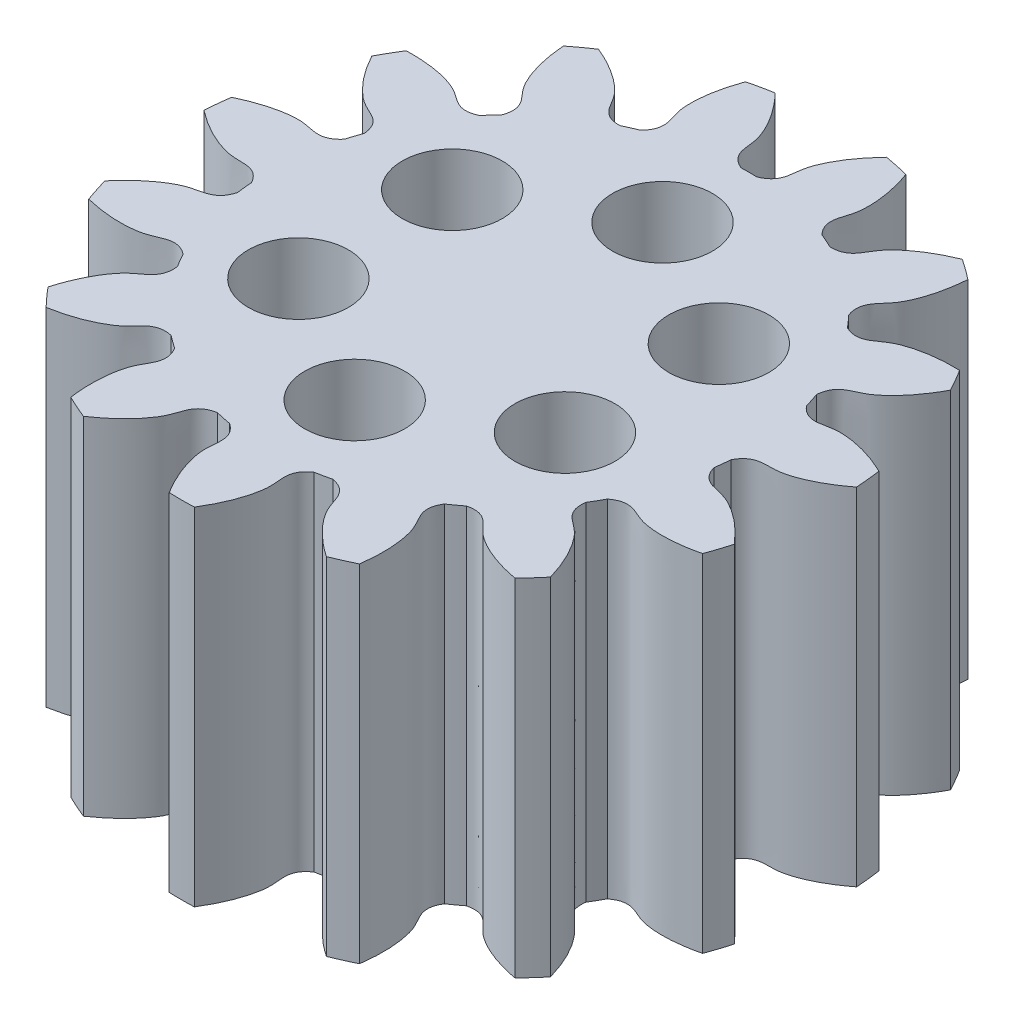
from build123d import *

# Parameters (mm, degrees)
EXTRUDE_1_DEPTH     = 18
SKETCH_2_R          = 2.6
CUT_EXTRUDE_1_DEPTH = 18


with BuildPart() as part:
    # 草图1 → 凸台-拉伸1 (new body)
    with BuildSketch(Plane(origin=(0, 0, 0), x_dir=(1, 0, 0), z_dir=(0, 1, 0))):
        with BuildLine():
            ThreePointArc((-4.070261012, 11.278074926), (-4.446224934, 11.11799604), (-4.816755697, 10.945714078))
            add(Edge.make_bspline(
                [(-4.816755697, 10.945714078), (-5.797025738, 10.920305027), (-5.927817302, 11.632519905), (-6.345451197, 12.170885551), (-6.388578566, 12.22303297), (-6.438114064, 12.279584992), (-6.498899692, 12.346247241), (-6.587266197, 12.437301497), (-6.709824462, 12.553923761), (-6.853878886, 12.680457628), (-7.02039085, 12.81534681), (-7.210231071, 12.956974861), (-7.424175956, 13.103670237), (-7.662904732, 13.253711239), (-7.926996695, 13.405331149), (-8.216928748, 13.556723506), (-8.516501887, 13.698220395), (-8.720849013, 13.785665189), (-8.81872037, 13.825629345)],
                knots=[0.470856003, 0.470856003, 0.470856003, 0.470856003, 0.673329104, 0.677834905, 0.68864883, 0.694956952, 0.701865848, 0.717485961, 0.735509167, 0.755935469, 0.778764864, 0.803997353, 0.831632937, 0.861671615, 0.894113387, 0.928958254, 0.966206214, 1, 1, 1, 1], degree=3))
            ThreePointArc((-8.81872037, 13.825629345), (-9.354366185, 13.451966724), (-9.875264115, 13.058005381))
            add(Edge.make_bspline(
                [(-9.875264115, 13.058005381), (-9.863151908, 12.893533817), (-9.835561849, 12.617123152), (-9.779430885, 12.238256379), (-9.720708052, 11.927964394), (-9.654716934, 11.642243515), (-9.58332055, 11.381143542), (-9.508372922, 11.144604888), (-9.431713259, 10.932459494), (-9.366147044, 10.771417396), (-9.30328234, 10.629675696), (-9.254588243, 10.527943239), (-9.206230218, 10.434459348), (-9.172603952, 10.37251769), (-9.140536365, 10.316160262), (-9.102059506, 10.251573668), (-9.065791453, 10.194442664), (-8.682831268, 9.630885093), (-8.045891484, 9.286408423), (-8.372977029, 8.361968042)],
                knots=[0, 0, 0, 0, 0.052718153, 0.088764566, 0.122407886, 0.153648111, 0.182485242, 0.208919278, 0.232950221, 0.254578069, 0.264490833, 0.282514039, 0.290624482, 0.298134152, 0.305043048, 0.31135117, 0.322165095, 0.326670896, 0.529143997, 0.529143997, 0.529143997, 0.529143997], degree=3))
            ThreePointArc((-8.372977029, 8.361968042), (-8.651327214, 8.062810399), (-8.919750523, 7.754714557))
            add(Edge.make_bspline(
                [(-8.919750523, 7.754714557), (-9.804936973, 7.332790488), (-10.214104901, 7.930233433), (-10.814605485, 8.252187915), (-10.875214563, 8.282285471), (-10.943469272, 8.313800412), (-11.026113685, 8.349975665), (-11.143875608, 8.39721597), (-11.303272702, 8.453906773), (-11.486338927, 8.510909), (-11.693319549, 8.566409882), (-11.924352537, 8.61857857), (-12.179467301, 8.665572241), (-12.458584063, 8.705541775), (-12.761513449, 8.736637577), (-13.087956379, 8.757015387), (-13.419182028, 8.764431854), (-13.641429419, 8.761201185), (-13.747094239, 8.75790239)],
                knots=[0.470856003, 0.470856003, 0.470856003, 0.470856003, 0.673329104, 0.677834905, 0.68864883, 0.694956952, 0.701865848, 0.717485961, 0.735509167, 0.755935469, 0.778764864, 0.803997353, 0.831632937, 0.861671615, 0.894113387, 0.928958254, 0.966206214, 1, 1, 1, 1], degree=3))
            ThreePointArc((-13.747094239, 8.75790239), (-14.08444876, 8.19867782), (-14.400074185, 7.626907949))
            add(Edge.make_bspline(
                [(-14.400074185, 7.626907949), (-14.32211252, 7.481582177), (-14.184481401, 7.240290357), (-13.979104214, 6.917008858), (-13.799251117, 6.657427752), (-13.622752079, 6.423249747), (-13.451329311, 6.213762578), (-13.286652308, 6.028157712), (-13.130332915, 5.865533545), (-13.004933475, 5.74508245), (-12.889852167, 5.641164343), (-12.803989578, 5.568032792), (-12.721789, 5.502299989), (-12.665875936, 5.459390503), (-12.613658106, 5.420948493), (-12.552238012, 5.377595652), (-12.495868224, 5.340155429), (-11.916797172, 4.98108391), (-11.194812441, 4.925455562), (-11.117616178, 3.947899575)],
                knots=[0, 0, 0, 0, 0.052718153, 0.088764566, 0.122407886, 0.153648111, 0.182485242, 0.208919278, 0.232950221, 0.254578069, 0.264490833, 0.282514039, 0.290624482, 0.298134152, 0.305043048, 0.31135117, 0.322165095, 0.326670896, 0.529143997, 0.529143997, 0.529143997, 0.529143997], degree=3))
            ThreePointArc((-11.117616178, 3.947899575), (-11.25022335, 3.561390249), (-11.370126375, 3.170753097))
            add(Edge.make_bspline(
                [(-11.370126375, 3.170753097), (-12.007172457, 2.425268515), (-12.623967896, 2.804636213), (-13.303503162, 2.854510677), (-13.371114089, 2.85735423), (-13.44628615, 2.85838287), (-13.536499379, 2.857816096), (-13.663294612, 2.853074174), (-13.83196933, 2.84003116), (-14.022393542, 2.817645544), (-14.234053992, 2.784161519), (-14.466332046, 2.737850405), (-14.718505027, 2.677016737), (-14.989747952, 2.600003708), (-15.279135518, 2.505198655), (-15.585644376, 2.39103841), (-15.891250613, 2.26309208), (-16.092969675, 2.16974456), (-16.188157552, 2.123753207)],
                knots=[0.470856003, 0.470856003, 0.470856003, 0.470856003, 0.673329104, 0.677834905, 0.68864883, 0.694956952, 0.701865848, 0.717485961, 0.735509167, 0.755935469, 0.778764864, 0.803997353, 0.831632937, 0.861671615, 0.894113387, 0.928958254, 0.966206214, 1, 1, 1, 1], degree=3))
            ThreePointArc((-16.188157552, 2.123753207), (-16.268889117, 1.475661695), (-16.324667532, 0.824947501))
            add(Edge.make_bspline(
                [(-16.324667532, 0.824947501), (-16.194336691, 0.723895669), (-15.970462183, 0.559444242), (-15.651350355, 0.347646324), (-15.381465227, 0.183660029), (-15.124976557, 0.041516402), (-14.883167958, -0.080135728), (-14.65723573, -0.182714039), (-14.44828565, -0.267697783), (-14.284735688, -0.326730787), (-14.13733638, -0.374856916), (-14.02915172, -0.406742451), (-13.927321815, -0.433358368), (-13.85878983, -0.449816241), (-13.795450694, -0.46369586), (-13.721707457, -0.478318848), (-13.654982783, -0.489594536), (-12.979927509, -0.582093275), (-12.29773555, -0.339254654), (-11.829605414, -1.200897937)],
                knots=[0, 0, 0, 0, 0.052718153, 0.088764566, 0.122407886, 0.153648111, 0.182485242, 0.208919278, 0.232950221, 0.254578069, 0.264490833, 0.282514039, 0.290624482, 0.298134152, 0.305043048, 0.31135117, 0.322165095, 0.326670896, 0.529143997, 0.529143997, 0.529143997, 0.529143997], degree=3))
            ThreePointArc((-11.829605414, -1.200897937), (-11.793540588, -1.607927971), (-11.744191008, -2.013561722))
            add(Edge.make_bspline(
                [(-11.744191008, -2.013561722), (-12.022945666, -2.95370576), (-12.740719083, -2.858009429), (-13.38179121, -3.088838732), (-13.444713442, -3.113740858), (-13.513804922, -3.143376381), (-13.59598828, -3.18058718), (-13.709892776, -3.236491409), (-13.858679726, -3.317012984), (-14.023535851, -3.414915767), (-14.203278113, -3.531595006), (-14.396638247, -3.668378311), (-14.602266447, -3.826520623), (-14.818735167, -4.007199962), (-15.044543176, -4.211513215), (-15.278119796, -4.440472173), (-15.505264524, -4.681658216), (-15.6515762, -4.848981953), (-15.719828284, -4.929713542)],
                knots=[0.470856003, 0.470856003, 0.470856003, 0.470856003, 0.673329104, 0.677834905, 0.68864883, 0.694956952, 0.701865848, 0.717485961, 0.735509167, 0.755935469, 0.778764864, 0.803997353, 0.831632937, 0.861671615, 0.894113387, 0.928958254, 0.966206214, 1, 1, 1, 1], degree=3))
            ThreePointArc((-15.719828284, -4.929713542), (-15.529977673, -5.554611085), (-15.316264484, -6.171755206))
            add(Edge.make_bspline(
                [(-15.316264484, -6.171755206), (-15.156099853, -6.21106032), (-14.884691891, -6.270236208), (-14.507022756, -6.33392876), (-14.193771189, -6.373965524), (-13.901642108, -6.399496848), (-13.631258581, -6.412279181), (-13.383136862, -6.414094215), (-13.157685464, -6.406743075), (-12.984264253, -6.394150644), (-12.830033624, -6.378163352), (-12.718233004, -6.363289572), (-12.614381089, -6.346186468), (-12.545079984, -6.333347014), (-12.481571455, -6.320264329), (-12.408255951, -6.303629017), (-12.342713693, -6.2867905), (-11.688397387, -6.096722587), (-11.163955387, -5.597406), (-10.385835331, -6.194150628)],
                knots=[0, 0, 0, 0, 0.052718153, 0.088764566, 0.122407886, 0.153648111, 0.182485242, 0.208919278, 0.232950221, 0.254578069, 0.264490833, 0.282514039, 0.290624482, 0.298134152, 0.305043048, 0.31135117, 0.322165095, 0.326670896, 0.529143997, 0.529143997, 0.529143997, 0.529143997], degree=3))
            ThreePointArc((-10.385835331, -6.194150628), (-10.187334443, -6.55132218), (-9.977265249, -6.901814768))
            add(Edge.make_bspline(
                [(-9.977265249, -6.901814768), (-9.84952927, -7.874058818), (-10.544171119, -8.078580619), (-11.035932913, -8.550201205), (-11.083286625, -8.598543207), (-11.13435098, -8.653718641), (-11.194294218, -8.721139381), (-11.275612854, -8.818539567), (-11.378785422, -8.952616791), (-11.489568336, -9.10910846), (-11.606313341, -9.288808014), (-11.727321831, -9.492412432), (-11.850850266, -9.720519147), (-11.975115374, -9.973623697), (-12.098299568, -10.252117533), (-12.21855643, -10.556286119), (-12.327964264, -10.869008617), (-12.393569936, -11.081376777), (-12.423084821, -11.182889377)],
                knots=[0.470856003, 0.470856003, 0.470856003, 0.470856003, 0.673329104, 0.677834905, 0.68864883, 0.694956952, 0.701865848, 0.717485961, 0.735509167, 0.755935469, 0.778764864, 0.803997353, 0.831632937, 0.861671615, 0.894113387, 0.928958254, 0.966206214, 1, 1, 1, 1], degree=3))
            ThreePointArc((-12.423084821, -11.182889377), (-11.995478929, -11.676542489), (-11.549227088, -12.153406712))
            add(Edge.make_bspline(
                [(-11.549227088, -12.153406712), (-11.386922587, -12.124168896), (-11.114910074, -12.067837197), (-10.743986056, -11.972411362), (-10.441532091, -11.881575875), (-10.164274371, -11.786080298), (-9.912067685, -11.687782653), (-9.684658975, -11.588520574), (-9.481688852, -11.490105628), (-9.328382496, -11.408065109), (-9.193988423, -11.330728742), (-9.097903185, -11.271667459), (-9.009986199, -11.213802617), (-8.951898766, -11.173885893), (-8.899202045, -11.13610302), (-8.83899119, -11.091085804), (-8.7859642, -11.049044615), (-8.265524096, -10.60927452), (-7.989512842, -9.939816341), (-7.035946892, -10.168479745)],
                knots=[0, 0, 0, 0, 0.052718153, 0.088764566, 0.122407886, 0.153648111, 0.182485242, 0.208919278, 0.232950221, 0.254578069, 0.264490833, 0.282514039, 0.290624482, 0.298134152, 0.305043048, 0.31135117, 0.322165095, 0.326670896, 0.529143997, 0.529143997, 0.529143997, 0.529143997], degree=3))
            ThreePointArc((-7.035946892, -10.168479745), (-6.70933255, -10.41403461), (-6.374866613, -10.648782683))
            add(Edge.make_bspline(
                [(-6.374866613, -10.648782683), (-5.862726708, -11.485016915), (-6.414127103, -11.954393171), (-6.671548482, -12.585257556), (-6.695145787, -12.648680663), (-6.719353526, -12.719855674), (-6.746691913, -12.805828696), (-6.781363959, -12.927883463), (-6.82108267, -13.092333166), (-6.858637002, -13.28035489), (-6.892198478, -13.492003072), (-6.919931857, -13.727223551), (-6.940001337, -13.985852945), (-6.950576268, -14.26761863), (-6.94983698, -14.572138934), (-6.935980581, -14.898923636), (-6.908733912, -15.229110029), (-6.882289762, -15.449802228), (-6.867964058, -15.554543388)],
                knots=[0.470856003, 0.470856003, 0.470856003, 0.470856003, 0.673329104, 0.677834905, 0.68864883, 0.694956952, 0.701865848, 0.717485961, 0.735509167, 0.755935469, 0.778764864, 0.803997353, 0.831632937, 0.861671615, 0.894113387, 0.928958254, 0.966206214, 1, 1, 1, 1], degree=3))
            ThreePointArc((-6.867964058, -15.554543388), (-6.276539828, -15.83159496), (-5.674910332, -16.08572513))
            add(Edge.make_bspline(
                [(-5.674910332, -16.08572513), (-5.538529883, -15.992999868), (-5.312946254, -15.830900844), (-5.012903487, -15.592856616), (-4.773544161, -15.386855159), (-4.559098181, -15.186844734), (-4.368677163, -14.994463666), (-4.201302494, -14.811287789), (-4.055909025, -14.638825876), (-3.949225585, -14.50152282), (-3.857906024, -14.376209539), (-3.79415018, -14.283172985), (-3.737369768, -14.194551762), (-3.700539852, -14.134459733), (-3.667766681, -14.078509673), (-3.631071479, -14.012894439), (-3.599728605, -13.952919882), (-3.303153524, -13.339487848), (-3.323297869, -12.615643478), (-2.359166242, -12.43668768)],
                knots=[0, 0, 0, 0, 0.052718153, 0.088764566, 0.122407886, 0.153648111, 0.182485242, 0.208919278, 0.232950221, 0.254578069, 0.264490833, 0.282514039, 0.290624482, 0.298134152, 0.305043048, 0.31135117, 0.322165095, 0.326670896, 0.529143997, 0.529143997, 0.529143997, 0.529143997], degree=3))
            ThreePointArc((-2.359166242, -12.43668768), (-1.960913031, -12.52816719), (-1.559882551, -12.606580673))
            add(Edge.make_bspline(
                [(-1.559882551, -12.606580673), (-0.751892363, -13.162212591), (-1.064709167, -13.815283884), (-1.043279635, -14.496309885), (-1.039040345, -14.563847665), (-1.03220573, -14.638715447), (-1.022212211, -14.728375235), (-1.004242555, -14.853980204), (-0.973639682, -15.020367538), (-0.931471947, -15.207408653), (-0.87604681, -15.414409571), (-0.805709724, -15.640574352), (-0.718850055, -15.885007053), (-0.613906306, -16.146714027), (-0.489371367, -16.424606472), (-0.343797604, -16.717503247), (-0.184607628, -17.008061307), (-0.070686091, -17.198917859), (-0.014996841, -17.288776881)],
                knots=[0.470856003, 0.470856003, 0.470856003, 0.470856003, 0.673329104, 0.677834905, 0.68864883, 0.694956952, 0.701865848, 0.717485961, 0.735509167, 0.755935469, 0.778764864, 0.803997353, 0.831632937, 0.861671615, 0.894113387, 0.928958254, 0.966206214, 1, 1, 1, 1], degree=3))
            ThreePointArc((-0.014996841, -17.288776881), (0.637983104, -17.30132218), (1.290963049, -17.288776881))
            add(Edge.make_bspline(
                [(1.290963049, -17.288776881), (1.377838027, -17.148597213), (1.517987314, -16.908759258), (1.695268711, -16.569256647), (1.830145994, -16.283708742), (1.944700577, -16.01376709), (2.040410403, -15.760567033), (2.118810431, -15.525150132), (2.181487394, -15.308461483), (2.223101382, -15.139636835), (2.255556449, -14.988014445), (2.275958935, -14.877089486), (2.291784924, -14.773035296), (2.300989096, -14.703158419), (2.308171938, -14.638715447), (2.315006553, -14.563847665), (2.319245844, -14.496309885), (2.340675375, -13.815283884), (2.027858571, -13.162212591), (2.835848759, -12.606580673)],
                knots=[0, 0, 0, 0, 0.052718153, 0.088764566, 0.122407886, 0.153648111, 0.182485242, 0.208919278, 0.232950221, 0.254578069, 0.264490833, 0.282514039, 0.290624482, 0.298134152, 0.305043048, 0.31135117, 0.322165095, 0.326670896, 0.529143997, 0.529143997, 0.529143997, 0.529143997], degree=3))
            ThreePointArc((2.835848759, -12.606580673), (3.236879239, -12.52816719), (3.63513245, -12.43668768))
            add(Edge.make_bspline(
                [(3.63513245, -12.43668768), (4.599264077, -12.615643478), (4.579119732, -13.339487848), (4.875694813, -13.952919882), (4.907037687, -14.012894439), (4.943732889, -14.078509673), (4.989330344, -14.156353234), (5.056834586, -14.263790166), (5.152467526, -14.40334525), (5.267066145, -14.557064647), (5.401894385, -14.723625961), (5.558140014, -14.9016291), (5.736910007, -15.089600474), (5.939226708, -15.285997222), (6.166024076, -15.48921168), (6.418144177, -15.697576015), (6.681752067, -15.898265615), (6.863452922, -16.026285687), (6.95087654, -16.08572513)],
                knots=[0.470856003, 0.470856003, 0.470856003, 0.470856003, 0.673329104, 0.677834905, 0.68864883, 0.694956952, 0.701865848, 0.717485961, 0.735509167, 0.755935469, 0.778764864, 0.803997353, 0.831632937, 0.861671615, 0.894113387, 0.928958254, 0.966206214, 1, 1, 1, 1], degree=3))
            ThreePointArc((6.95087654, -16.08572513), (7.552506036, -15.83159496), (8.143930266, -15.554543388))
            add(Edge.make_bspline(
                [(8.143930266, -15.554543388), (8.1662783, -15.391147653), (8.196760159, -15.115040927), (8.220626623, -14.732783019), (8.227700356, -14.417062494), (8.222556013, -14.123864977), (8.207005549, -13.853626522), (8.182874857, -13.606674318), (8.151997899, -13.383226369), (8.121346999, -13.212071445), (8.089325795, -13.060356835), (8.062847149, -12.950723403), (8.034982257, -12.849228161), (8.0149692, -12.781648784), (7.995319735, -12.719855674), (7.971111996, -12.648680663), (7.94751469, -12.585257556), (7.690093312, -11.954393171), (7.138692917, -11.485016915), (7.650832821, -10.648782683)],
                knots=[0, 0, 0, 0, 0.052718153, 0.088764566, 0.122407886, 0.153648111, 0.182485242, 0.208919278, 0.232950221, 0.254578069, 0.264490833, 0.282514039, 0.290624482, 0.298134152, 0.305043048, 0.31135117, 0.322165095, 0.326670896, 0.529143997, 0.529143997, 0.529143997, 0.529143997], degree=3))
            ThreePointArc((7.650832821, -10.648782683), (7.985298758, -10.41403461), (8.311913101, -10.168479745))
            add(Edge.make_bspline(
                [(8.311913101, -10.168479745), (9.26547905, -9.939816341), (9.541490304, -10.60927452), (10.061930408, -11.049044615), (10.114957398, -11.091085804), (10.175168254, -11.13610302), (10.248485431, -11.188670496), (10.353852161, -11.259362568), (10.497979365, -11.34795506), (10.665193724, -11.44177326), (10.856112041, -11.539095006), (11.071249924, -11.638158142), (11.311019285, -11.73716623), (11.575726542, -11.834293972), (11.865571014, -11.927692817), (12.180643598, -12.015496625), (12.503089202, -12.091616709), (12.721151647, -12.134664468), (12.825193296, -12.153406712)],
                knots=[0.470856003, 0.470856003, 0.470856003, 0.470856003, 0.673329104, 0.677834905, 0.68864883, 0.694956952, 0.701865848, 0.717485961, 0.735509167, 0.755935469, 0.778764864, 0.803997353, 0.831632937, 0.861671615, 0.894113387, 0.928958254, 0.966206214, 1, 1, 1, 1], degree=3))
            ThreePointArc((12.825193296, -12.153406712), (13.271445137, -11.676542489), (13.699051029, -11.182889377))
            add(Edge.make_bspline(
                [(13.699051029, -11.182889377), (13.653007941, -11.024530181), (13.568551783, -10.759896047), (13.434876583, -10.400978706), (13.312923654, -10.109676509), (13.188969889, -9.843919641), (13.064847951, -9.603369472), (12.942358957, -9.387582244), (12.823266983, -9.196011175), (12.725651013, -9.052120216), (12.634690297, -8.92654622), (12.565908916, -8.837160933), (12.499171236, -8.755774088), (12.45340139, -8.702177298), (12.410317188, -8.653718641), (12.359252833, -8.598543207), (12.311899121, -8.550201205), (11.820137327, -8.078580619), (11.125495478, -7.874058818), (11.253231457, -6.901814768)],
                knots=[0, 0, 0, 0, 0.052718153, 0.088764566, 0.122407886, 0.153648111, 0.182485242, 0.208919278, 0.232950221, 0.254578069, 0.264490833, 0.282514039, 0.290624482, 0.298134152, 0.305043048, 0.31135117, 0.322165095, 0.326670896, 0.529143997, 0.529143997, 0.529143997, 0.529143997], degree=3))
            ThreePointArc((11.253231457, -6.901814768), (11.463300651, -6.55132218), (11.661801539, -6.194150628))
            add(Edge.make_bspline(
                [(11.661801539, -6.194150628), (12.439921595, -5.597406), (12.964363595, -6.096722587), (13.618679901, -6.2867905), (13.684222159, -6.303629017), (13.757537663, -6.320264329), (13.845897356, -6.338466325), (13.97090771, -6.360190237), (14.138608276, -6.38250169), (14.329525494, -6.400196673), (14.543522374, -6.411451037), (14.780353218, -6.414445254), (15.039663645, -6.407370659), (15.32099117, -6.388435125), (15.623766003, -6.355868848), (15.947312157, -6.307930053), (16.272841701, -6.246318767), (16.489560759, -6.196950865), (16.592230692, -6.171755206)],
                knots=[0.470856003, 0.470856003, 0.470856003, 0.470856003, 0.673329104, 0.677834905, 0.68864883, 0.694956952, 0.701865848, 0.717485961, 0.735509167, 0.755935469, 0.778764864, 0.803997353, 0.831632937, 0.861671615, 0.894113387, 0.928958254, 0.966206214, 1, 1, 1, 1], degree=3))
            ThreePointArc((16.592230692, -6.171755206), (16.805943881, -5.554611085), (16.995794492, -4.929713542))
            add(Edge.make_bspline(
                [(16.995794492, -4.929713542), (16.88932155, -4.803772629), (16.704530611, -4.596368732), (16.436427405, -4.322852028), (16.206534583, -4.106336953), (15.985204128, -3.913972513), (15.773972527, -3.744703939), (15.57430469, -3.597393258), (15.387589785, -3.470823449), (15.239887433, -3.379076509), (15.105715139, -3.301356011), (15.006523949, -3.247674396), (14.912453032, -3.200468473), (14.848840419, -3.170121643), (14.78977113, -3.143376381), (14.72067965, -3.113740858), (14.657757418, -3.088838732), (14.016685291, -2.858009429), (13.298911874, -2.95370576), (13.020157217, -2.013561722)],
                knots=[0, 0, 0, 0, 0.052718153, 0.088764566, 0.122407886, 0.153648111, 0.182485242, 0.208919278, 0.232950221, 0.254578069, 0.264490833, 0.282514039, 0.290624482, 0.298134152, 0.305043048, 0.31135117, 0.322165095, 0.326670896, 0.529143997, 0.529143997, 0.529143997, 0.529143997], degree=3))
            ThreePointArc((13.020157217, -2.013561722), (13.069506796, -1.607927971), (13.105571622, -1.200897937))
            add(Edge.make_bspline(
                [(13.105571622, -1.200897937), (13.573701758, -0.339254654), (14.255893718, -0.582093275), (14.930948991, -0.489594536), (14.997673665, -0.478318848), (15.071416902, -0.46369586), (15.159540917, -0.444385086), (15.282579469, -0.413384575), (15.444856444, -0.365557137), (15.6264652, -0.30406928), (15.82653864, -0.22731028), (16.04411224, -0.133717851), (16.278126606, -0.021783834), (16.527430312, 0.10994085), (16.790782987, 0.262841244), (17.066858642, 0.438233589), (17.339185111, 0.626923093), (17.517088087, 0.760170498), (17.60063374, 0.824947501)],
                knots=[0.470856003, 0.470856003, 0.470856003, 0.470856003, 0.673329104, 0.677834905, 0.68864883, 0.694956952, 0.701865848, 0.717485961, 0.735509167, 0.755935469, 0.778764864, 0.803997353, 0.831632937, 0.861671615, 0.894113387, 0.928958254, 0.966206214, 1, 1, 1, 1], degree=3))
            ThreePointArc((17.60063374, 0.824947501), (17.544855325, 1.475661695), (17.46412376, 2.123753207))
            add(Edge.make_bspline(
                [(17.46412376, 2.123753207), (17.315631103, 2.195499509), (17.062457416, 2.309811151), (16.706283683, 2.450633696), (16.408201525, 2.554924224), (16.127764427, 2.640634678), (15.865947026, 2.709353583), (15.623624728, 2.76271636), (15.401571596, 2.802399841), (15.229321941, 2.826138882), (15.075137676, 2.842567301), (14.962687735, 2.851263205), (14.857549298, 2.856125873), (14.787093116, 2.857975501), (14.722252358, 2.85838287), (14.647080297, 2.85735423), (14.57946937, 2.854510677), (13.899934105, 2.804636213), (13.283138665, 2.425268515), (12.646092584, 3.170753097)],
                knots=[0, 0, 0, 0, 0.052718153, 0.088764566, 0.122407886, 0.153648111, 0.182485242, 0.208919278, 0.232950221, 0.254578069, 0.264490833, 0.282514039, 0.290624482, 0.298134152, 0.305043048, 0.31135117, 0.322165095, 0.326670896, 0.529143997, 0.529143997, 0.529143997, 0.529143997], degree=3))
            ThreePointArc((12.646092584, 3.170753097), (12.526189558, 3.561390249), (12.393582386, 3.947899575))
            add(Edge.make_bspline(
                [(12.393582386, 3.947899575), (12.470778649, 4.925455562), (13.19276338, 4.98108391), (13.771834432, 5.340155429), (13.82820422, 5.377595652), (13.889624314, 5.420948493), (13.962275208, 5.474433029), (14.062067474, 5.552797692), (14.190861696, 5.662494224), (14.331760186, 5.792533112), (14.48331567, 5.944033147), (14.644011574, 6.118029241), (14.812266668, 6.315468271), (14.986439681, 6.537205711), (15.164834129, 6.784002354), (15.345703295, 7.056521319), (15.517738968, 7.339662912), (15.626064822, 7.533750133), (15.676040393, 7.626907949)],
                knots=[0.470856003, 0.470856003, 0.470856003, 0.470856003, 0.673329104, 0.677834905, 0.68864883, 0.694956952, 0.701865848, 0.717485961, 0.735509167, 0.755935469, 0.778764864, 0.803997353, 0.831632937, 0.861671615, 0.894113387, 0.928958254, 0.966206214, 1, 1, 1, 1], degree=3))
            ThreePointArc((15.676040393, 7.626907949), (15.360414968, 8.19867782), (15.023060447, 8.75790239))
            add(Edge.make_bspline(
                [(15.023060447, 8.75790239), (14.858223806, 8.763048494), (14.5804434, 8.764502359), (14.197784815, 8.748281248), (13.883054435, 8.722314449), (13.592000814, 8.686550802), (13.32486822, 8.642837914), (13.08179119, 8.593025879), (12.862794833, 8.538961397), (12.695781405, 8.490587844), (12.548245031, 8.442883561), (12.441979955, 8.405090153), (12.343953388, 8.366768766), (12.278836152, 8.339801375), (12.21943548, 8.313800412), (12.151180771, 8.282285471), (12.090571693, 8.252187915), (11.490071109, 7.930233433), (11.080903182, 7.332790488), (10.195716731, 7.754714557)],
                knots=[0, 0, 0, 0, 0.052718153, 0.088764566, 0.122407886, 0.153648111, 0.182485242, 0.208919278, 0.232950221, 0.254578069, 0.264490833, 0.282514039, 0.290624482, 0.298134152, 0.305043048, 0.31135117, 0.322165095, 0.326670896, 0.529143997, 0.529143997, 0.529143997, 0.529143997], degree=3))
            ThreePointArc((10.195716731, 7.754714557), (9.927293423, 8.062810399), (9.648943238, 8.361968042))
            add(Edge.make_bspline(
                [(9.648943238, 8.361968042), (9.321857692, 9.286408423), (9.958797477, 9.630885093), (10.341757662, 10.194442664), (10.378025714, 10.251573668), (10.416502573, 10.316160262), (10.461118347, 10.394570597), (10.520409338, 10.506749451), (10.593451116, 10.659347549), (10.66927671, 10.835452562), (10.746108919, 11.035497901), (10.822141344, 11.259812154), (10.895544333, 11.508617196), (10.964470556, 11.782026973), (11.027060755, 12.080046484), (11.081449512, 12.402571064), (11.123447858, 12.731206993), (11.143466065, 12.952574586), (11.151230324, 13.058005381)],
                knots=[0.470856003, 0.470856003, 0.470856003, 0.470856003, 0.673329104, 0.677834905, 0.68864883, 0.694956952, 0.701865848, 0.717485961, 0.735509167, 0.755935469, 0.778764864, 0.803997353, 0.831632937, 0.861671615, 0.894113387, 0.928958254, 0.966206214, 1, 1, 1, 1], degree=3))
            ThreePointArc((11.151230324, 13.058005381), (10.630332393, 13.451966724), (10.094686578, 13.825629345))
            add(Edge.make_bspline(
                [(10.094686578, 13.825629345), (9.942007704, 13.763285443), (9.687651336, 13.651630145), (9.344673044, 13.481170153), (9.067714183, 13.329435924), (8.816369856, 13.178382034), (8.590111722, 13.029795709), (8.388310184, 12.885421815), (8.210237064, 12.746957611), (8.077338002, 12.63483569), (7.961959897, 12.53124721), (7.880253883, 12.453499313), (7.806288871, 12.378619988), (7.757769942, 12.327498484), (7.714080272, 12.279584992), (7.664544774, 12.22303297), (7.621417405, 12.170885551), (7.20378351, 11.632519905), (7.072991946, 10.920305027), (6.092721906, 10.945714078)],
                knots=[0, 0, 0, 0, 0.052718153, 0.088764566, 0.122407886, 0.153648111, 0.182485242, 0.208919278, 0.232950221, 0.254578069, 0.264490833, 0.282514039, 0.290624482, 0.298134152, 0.305043048, 0.31135117, 0.322165095, 0.326670896, 0.529143997, 0.529143997, 0.529143997, 0.529143997], degree=3))
            ThreePointArc((6.092721906, 10.945714078), (5.722191143, 11.11799604), (5.34622722, 11.278074926))
            add(Edge.make_bspline(
                [(5.34622722, 11.278074926), (4.671415929, 11.98955556), (5.113178091, 12.563317407), (5.233810114, 13.233916806), (5.243705356, 13.300860121), (5.252585981, 13.375512859), (5.261452162, 13.465291135), (5.269989927, 13.591887436), (5.274649673, 13.761001503), (5.272291438, 13.952722486), (5.261115384, 14.166723471), (5.239337635, 14.402569911), (5.205196475, 14.659720312), (5.156957937, 14.937527393), (5.092921474, 15.235239491), (5.01142551, 15.552002256), (4.916124635, 15.869308383), (4.844373865, 16.07967988), (4.8085843, 16.179153713)],
                knots=[0.470856003, 0.470856003, 0.470856003, 0.470856003, 0.673329104, 0.677834905, 0.68864883, 0.694956952, 0.701865848, 0.717485961, 0.735509167, 0.755935469, 0.778764864, 0.803997353, 0.831632937, 0.861671615, 0.894113387, 0.928958254, 0.966206214, 1, 1, 1, 1], degree=3))
            ThreePointArc((4.8085843, 16.179153713), (4.172481848, 16.327187032), (3.531162767, 16.450678042))
            add(Edge.make_bspline(
                [(3.531162767, 16.450678042), (3.417041224, 16.33162396), (3.230089421, 16.126165714), (2.986095485, 15.830940925), (2.794796847, 15.579675492), (2.626621531, 15.339449948), (2.480359943, 15.111682112), (2.354727218, 14.897709917), (2.248367793, 14.698787709), (2.172562552, 14.542304319), (2.109292639, 14.40074303), (2.0662734, 14.296483963), (2.029159165, 14.197994015), (2.005627906, 14.131557771), (1.985203579, 14.070016428), (1.96295243, 13.998205683), (1.944763884, 13.933025164), (1.782209372, 13.271336665), (1.952409221, 12.567498277), (1.046553186, 12.191998855)],
                knots=[0, 0, 0, 0, 0.052718153, 0.088764566, 0.122407886, 0.153648111, 0.182485242, 0.208919278, 0.232950221, 0.254578069, 0.264490833, 0.282514039, 0.290624482, 0.298134152, 0.305043048, 0.31135117, 0.322165095, 0.326670896, 0.529143997, 0.529143997, 0.529143997, 0.529143997], degree=3))
            ThreePointArc((1.046553186, 12.191998855), (0.637983104, 12.19867782), (0.229413022, 12.191998855))
            add(Edge.make_bspline(
                [(0.229413022, 12.191998855), (-0.676443013, 12.567498277), (-0.506243164, 13.271336665), (-0.668797676, 13.933025164), (-0.686986221, 13.998205683), (-0.709237371, 14.070016428), (-0.737653826, 14.155639165), (-0.781345544, 14.274763263), (-0.845873542, 14.43115194), (-0.926007845, 14.605338592), (-1.023259721, 14.796292509), (-1.139082075, 15.002891145), (-1.274864068, 15.223923265), (-1.431926483, 15.458092281), (-1.611517123, 15.704019839), (-1.814806414, 15.96024963), (-2.030928125, 16.211360843), (-2.182041511, 16.374361101), (-2.255196559, 16.450678042)],
                knots=[0.470856003, 0.470856003, 0.470856003, 0.470856003, 0.673329104, 0.677834905, 0.68864883, 0.694956952, 0.701865848, 0.717485961, 0.735509167, 0.755935469, 0.778764864, 0.803997353, 0.831632937, 0.861671615, 0.894113387, 0.928958254, 0.966206214, 1, 1, 1, 1], degree=3))
            ThreePointArc((-2.255196559, 16.450678042), (-2.89651564, 16.327187032), (-3.532618092, 16.179153713))
            add(Edge.make_bspline(
                [(-3.532618092, 16.179153713), (-3.588449652, 16.023974984), (-3.675671225, 15.760239388), (-3.778492037, 15.391296848), (-3.85105318, 15.083946287), (-3.906980445, 14.79608627), (-3.94795553, 14.52852005), (-3.975696402, 14.281947291), (-3.991951621, 14.056962535), (-3.997555625, 13.883175077), (-3.997777404, 13.728118212), (-3.994671451, 13.615375314), (-3.988517521, 13.510304549), (-3.98299234, 13.440040995), (-3.976619773, 13.375512859), (-3.967739148, 13.300860121), (-3.957843905, 13.233916806), (-3.837211883, 12.563317407), (-3.39544972, 11.98955556), (-4.070261012, 11.278074926)],
                knots=[0, 0, 0, 0, 0.052718153, 0.088764566, 0.122407886, 0.153648111, 0.182485242, 0.208919278, 0.232950221, 0.254578069, 0.264490833, 0.282514039, 0.290624482, 0.298134152, 0.305043048, 0.31135117, 0.322165095, 0.326670896, 0.529143997, 0.529143997, 0.529143997, 0.529143997], degree=3))
        make_face()
    extrude(amount=EXTRUDE_1_DEPTH)

    # 草图2 → 切除-拉伸1 (cut)
    with BuildSketch(Plane(origin=(0, 18, 0), x_dir=(1, 0, 0), z_dir=(0, 1, 0))):
        with Locations(Location((0.637983104, 7.69867782, 0), (0, 0, 270))):
            Circle(SKETCH_2_R)
        with Locations(Location((7.566186334, 3.69867782, 0), (0, 0, 270))):
            Circle(SKETCH_2_R)
        with Locations(Location((7.566186334, -4.30132218, 0), (0, 0, 270))):
            Circle(SKETCH_2_R)
        with Locations(Location((0.637983104, -8.30132218, 0), (0, 0, 270))):
            Circle(SKETCH_2_R)
        with Locations(Location((-6.290220126, -4.30132218, 0), (0, 0, 270))):
            Circle(SKETCH_2_R)
        with Locations(Location((-6.290220126, 3.69867782, 0), (0, 0, 270))):
            Circle(SKETCH_2_R)
    extrude(amount=-CUT_EXTRUDE_1_DEPTH, mode=Mode.SUBTRACT)


solid = part.part
